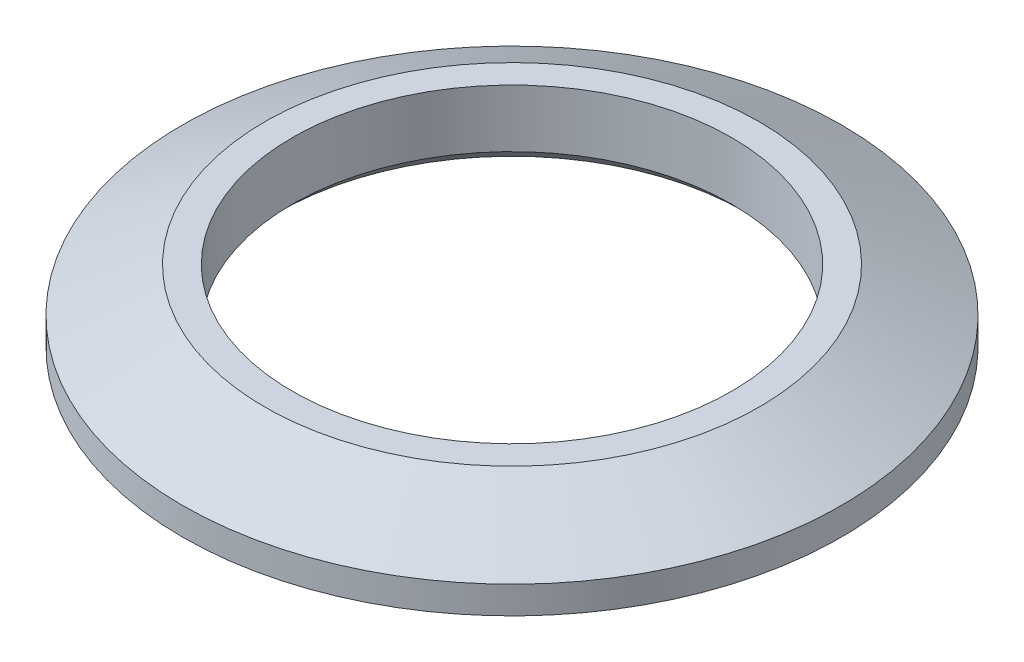
from build123d import *


with BuildPart() as part:
    # Sketch1 → Revolve1 (revolve)
    with BuildSketch(Plane.XY, mode=Mode.PRIVATE) as revolve1_sk:
        Polygon((-4.25, 0), (-4, 0.25), (-4, 1.3), (-4.5, 1.3), (-6, 0.5), (-6, 0), align=None)
    revolve(revolve1_sk.sketch.rotate(Axis((0, 0, 0), (0, 1, 0)), 270), axis=Axis((0, 0, 0), (0, 1, 0)))


solid = part.part
